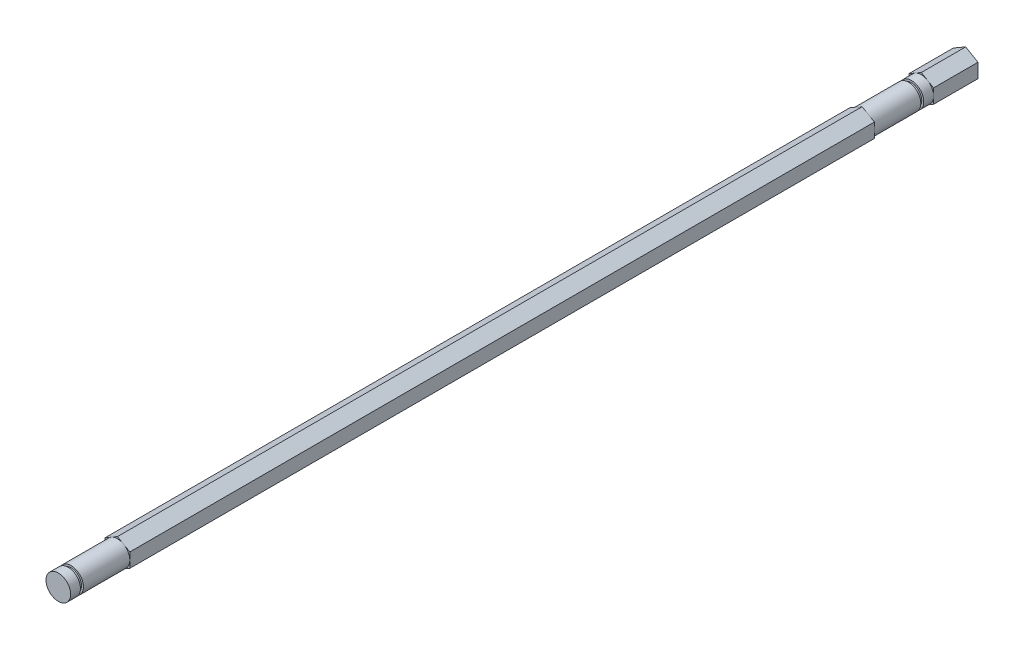
from build123d import *

# Parameters (mm, degrees)
BOSS_EXTRUDE2_DEPTH      = 111.125
BOSS_EXTRUDE2_DEPTH_BACK = 111.125
SKETCH4_OUTSIDE_W        = 52.842
SKETCH4_OUTSIDE_H        = 53.824
SKETCH4_OUTSIDE_R        = 3.175
CUT_EXTRUDE1_DEPTH       = 15.24
SKETCH5_OUTSIDE_W        = 52.842
SKETCH5_OUTSIDE_H        = 53.824
SKETCH5_OUTSIDE_R        = 3.175
CUT_EXTRUDE4_DEPTH       = 15.24
SKETCH7_OUTSIDE_W        = 52.842
SKETCH7_OUTSIDE_H        = 53.824
SKETCH7_OUTSIDE_R        = 2.667
CUT_EXTRUDE8_DEPTH       = 0.762
SKETCH8_OUTSIDE_W        = 52.842
SKETCH8_OUTSIDE_H        = 53.824
SKETCH8_OUTSIDE_R        = 2.667
CUT_EXTRUDE9_DEPTH       = 0.762
BOSS_EXTRUDE4_DEPTH      = 11.43


with BuildPart() as part:
    # Sketch3 → Boss-Extrude2 (new, two sides: drawn at the far end of the back side and taken through both)
    with BuildSketch(Plane.XY.offset(-BOSS_EXTRUDE2_DEPTH_BACK)):
        Polygon((0, 3.666174209), (-3.175, 1.833087105), (-3.175, -1.833087105), (0, -3.666174209), (3.175, -1.833087105), (3.175, 1.833087105), align=None)
    extrude(amount=BOSS_EXTRUDE2_DEPTH + BOSS_EXTRUDE2_DEPTH_BACK)

    # Sketch4 outside → Cut-Extrude1 (cut)
    with BuildSketch(Plane.XY.offset(111.125)):
        Rectangle(SKETCH4_OUTSIDE_W, SKETCH4_OUTSIDE_H)
        Circle(SKETCH4_OUTSIDE_R, mode=Mode.SUBTRACT)
    extrude(amount=-CUT_EXTRUDE1_DEPTH, mode=Mode.SUBTRACT)

    # Sketch5 outside → Cut-Extrude4 (cut)
    with BuildSketch(Plane(origin=(0, 0, -111.125), x_dir=(-1, 0, 0), z_dir=(0, 0, -1))):
        Rectangle(SKETCH5_OUTSIDE_W, SKETCH5_OUTSIDE_H)
        with Locations(Location((0, 0, 0), (0, 0, 180))):
            Circle(SKETCH5_OUTSIDE_R, mode=Mode.SUBTRACT)
    extrude(amount=-CUT_EXTRUDE4_DEPTH, mode=Mode.SUBTRACT)

    # Sketch7 outside → Cut-Extrude8 (cut)
    with BuildSketch(Plane(origin=(0, 0, -107.823), x_dir=(-1, 0, 0), z_dir=(0, 0, -1))):
        Rectangle(SKETCH7_OUTSIDE_W, SKETCH7_OUTSIDE_H)
        with Locations(Location((0, 0, 0), (0, 0, 180))):
            Circle(SKETCH7_OUTSIDE_R, mode=Mode.SUBTRACT)
    extrude(amount=CUT_EXTRUDE8_DEPTH, mode=Mode.SUBTRACT)

    # Sketch8 outside → Cut-Extrude9 (cut)
    with BuildSketch(Plane.XY.offset(107.823)):
        Rectangle(SKETCH8_OUTSIDE_W, SKETCH8_OUTSIDE_H)
        Circle(SKETCH8_OUTSIDE_R, mode=Mode.SUBTRACT)
    extrude(amount=CUT_EXTRUDE9_DEPTH, mode=Mode.SUBTRACT)

    # Sketch13 → Boss-Extrude4 (add)
    with BuildSketch(Plane(origin=(0, 0, -111.125), x_dir=(-1, 0, 0), z_dir=(0, 0, -1))):
        Polygon((0, 3.666174278), (-3.175000059, 1.833087139), (-3.175000059, -1.833087139), (0, -3.666174278), (3.175000059, -1.833087139), (3.175000059, 1.833087139), align=None)
    extrude(amount=BOSS_EXTRUDE4_DEPTH)


solid = part.part
